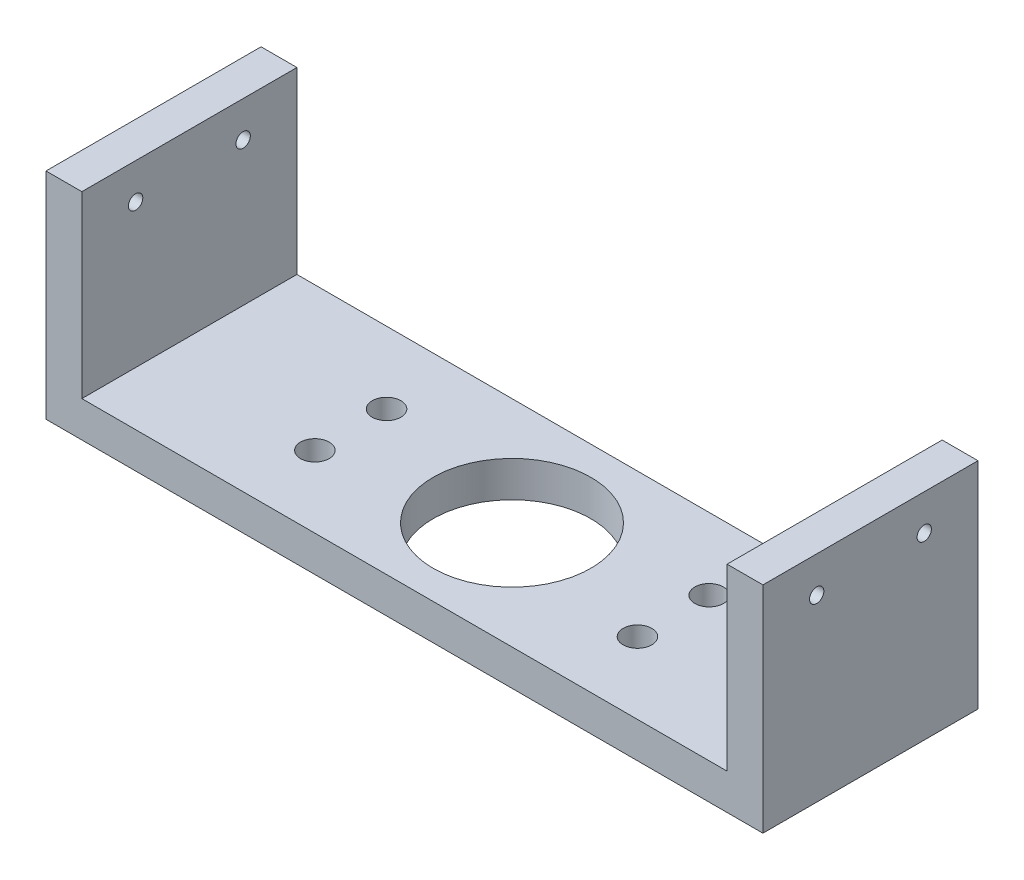
from build123d import *

# Parameters (mm, degrees)
SKETCH2_W           = 100
SKETCH2_H           = 30
SKETCH2_R           = 11
BOSS_EXTRUDE1_DEPTH = 5
SKETCH3_W           = 5
SKETCH3_H           = 30
BOSS_EXTRUDE2_DEPTH = 25
SKETCH4_R           = 1
CUT_EXTRUDE1_DEPTH  = 106.475115549
SKETCH5_R           = 2
CUT_EXTRUDE2_DEPTH  = 10


with BuildPart() as part:
    # Sketch2 → Boss-Extrude1 (new body)
    with BuildSketch(Plane(origin=(0, 0, 0), x_dir=(1, 0, 0), z_dir=(0, 1, 0))):
        Rectangle(SKETCH2_W, SKETCH2_H)
        with Locations(Location((0, 0, 0), (0, 0, 270))):
            Circle(SKETCH2_R, mode=Mode.SUBTRACT)
    extrude(amount=BOSS_EXTRUDE1_DEPTH)

    # Sketch3 → Boss-Extrude2 (add)
    with BuildSketch(Plane(origin=(0, 5, 0), x_dir=(1, 0, 0), z_dir=(0, 1, 0))):
        with Locations((-47.5, 0)):
            Rectangle(SKETCH3_W, SKETCH3_H)
        with Locations((47.5, 0)):
            Rectangle(SKETCH3_W, SKETCH3_H)
    extrude(amount=BOSS_EXTRUDE2_DEPTH)

    # Sketch4 → Cut-Extrude1 (cut, through all)
    with BuildSketch(Plane(origin=(50, 0, 0), x_dir=(0, 0, -1), z_dir=(1, 0, 0))):
        with Locations((-7.5, 25)):
            Circle(SKETCH4_R)
        with Locations((7.5, 25)):
            Circle(SKETCH4_R)
    extrude(amount=-CUT_EXTRUDE1_DEPTH, mode=Mode.SUBTRACT)

    # Sketch5 → Cut-Extrude2 (cut)
    with BuildSketch(Plane.XZ):
        with Locations(Location((-22.5, -5, 0), (0, 0, 270))):
            Circle(SKETCH5_R)
        with Locations(Location((22.5, -5, 0), (0, 0, 270))):
            Circle(SKETCH5_R)
        with Locations(Location((-22.5, 5, 0), (0, 0, 270))):
            Circle(SKETCH5_R)
        with Locations(Location((22.5, 5, 0), (0, 0, 270))):
            Circle(SKETCH5_R)
    extrude(amount=-CUT_EXTRUDE2_DEPTH, mode=Mode.SUBTRACT)


solid = part.part
